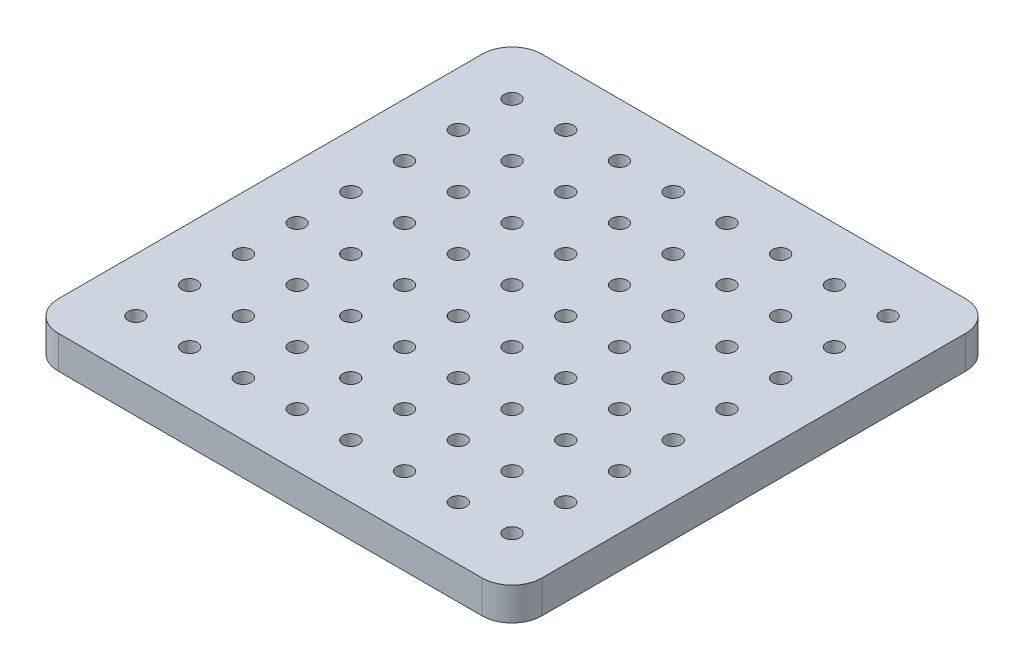
from build123d import *

# Parameters (mm, degrees)
SKETCH1_W               = 162
SKETCH1_H               = 162
BOSS_EXTRUDE1_DEPTH     = 5.5
SKETCH2_R               = 2.65
CUT_EXTRUDE1_DEPTH      = 10
MIRROR2_COPY_1_SKETCH_R = 2.65
MIRROR2_COPY_1_DEPTH    = 10
FILLET1_R               = 10


with BuildPart() as part:
    # Sketch1 → Boss-Extrude1 (new, symmetric)
    with BuildSketch(Plane(origin=(0, 0, 0), x_dir=(1, 0, 0), z_dir=(0, 1, 0))):
        Rectangle(SKETCH1_W, SKETCH1_H)
    extrude(amount=BOSS_EXTRUDE1_DEPTH, both=True)

    # Sketch2 → Cut-Extrude1 (cut)
    with BuildSketch(Plane(origin=(0, 5.5, 0), x_dir=(1, 0, 0), z_dir=(0, 1, 0))):
        with Locations(Location((9, -9, 0), (0, 0, 270))):
            Circle(SKETCH2_R)
        with Locations(Location((27, -9, 0), (0, 0, 270))):
            Circle(SKETCH2_R)
        with Locations(Location((45, -9, 0), (0, 0, 270))):
            Circle(SKETCH2_R)
        with Locations(Location((63, -9, 0), (0, 0, 270))):
            Circle(SKETCH2_R)
        with Locations(Location((9, -27, 0), (0, 0, 270))):
            Circle(SKETCH2_R)
        with Locations(Location((27, -27, 0), (0, 0, 270))):
            Circle(SKETCH2_R)
        with Locations(Location((45, -27, 0), (0, 0, 270))):
            Circle(SKETCH2_R)
        with Locations(Location((63, -27, 0), (0, 0, 270))):
            Circle(SKETCH2_R)
        with Locations(Location((9, -45, 0), (0, 0, 270))):
            Circle(SKETCH2_R)
        with Locations(Location((27, -45, 0), (0, 0, 270))):
            Circle(SKETCH2_R)
        with Locations(Location((45, -45, 0), (0, 0, 270))):
            Circle(SKETCH2_R)
        with Locations(Location((63, -45, 0), (0, 0, 270))):
            Circle(SKETCH2_R)
        with Locations(Location((9, -63, 0), (0, 0, 270))):
            Circle(SKETCH2_R)
        with Locations(Location((27, -63, 0), (0, 0, 270))):
            Circle(SKETCH2_R)
        with Locations(Location((45, -63, 0), (0, 0, 270))):
            Circle(SKETCH2_R)
        with Locations(Location((63, -63, 0), (0, 0, 270))):
            Circle(SKETCH2_R)
    cut_extrude1 = extrude(amount=-CUT_EXTRUDE1_DEPTH, mode=Mode.SUBTRACT)

    # Mirror1: Cut-Extrude1 across plane
    add(cut_extrude1.mirror(Plane.XY), mode=Mode.SUBTRACT)

    # Mirror2: Cut-Extrude1 across plane
    add(cut_extrude1.mirror(Plane(origin=(0, 0, 0), x_dir=(0, 0, 1), z_dir=(1, 0, 0))), mode=Mode.SUBTRACT)

    # Mirror2 copy 1 sketch → Mirror2 copy 1 (cut)
    with BuildSketch(Plane(origin=(0, 5.5, 0), x_dir=(-1, 0, 0), z_dir=(0, 1, 0))):
        with Locations(Location((9, -9, 0), (0, 0, 270))):
            Circle(MIRROR2_COPY_1_SKETCH_R)
        with Locations(Location((27, -9, 0), (0, 0, 270))):
            Circle(MIRROR2_COPY_1_SKETCH_R)
        with Locations(Location((45, -9, 0), (0, 0, 270))):
            Circle(MIRROR2_COPY_1_SKETCH_R)
        with Locations(Location((63, -9, 0), (0, 0, 270))):
            Circle(MIRROR2_COPY_1_SKETCH_R)
        with Locations(Location((9, -27, 0), (0, 0, 270))):
            Circle(MIRROR2_COPY_1_SKETCH_R)
        with Locations(Location((27, -27, 0), (0, 0, 270))):
            Circle(MIRROR2_COPY_1_SKETCH_R)
        with Locations(Location((45, -27, 0), (0, 0, 270))):
            Circle(MIRROR2_COPY_1_SKETCH_R)
        with Locations(Location((63, -27, 0), (0, 0, 270))):
            Circle(MIRROR2_COPY_1_SKETCH_R)
        with Locations(Location((9, -45, 0), (0, 0, 270))):
            Circle(MIRROR2_COPY_1_SKETCH_R)
        with Locations(Location((27, -45, 0), (0, 0, 270))):
            Circle(MIRROR2_COPY_1_SKETCH_R)
        with Locations(Location((45, -45, 0), (0, 0, 270))):
            Circle(MIRROR2_COPY_1_SKETCH_R)
        with Locations(Location((63, -45, 0), (0, 0, 270))):
            Circle(MIRROR2_COPY_1_SKETCH_R)
        with Locations(Location((9, -63, 0), (0, 0, 270))):
            Circle(MIRROR2_COPY_1_SKETCH_R)
        with Locations(Location((27, -63, 0), (0, 0, 270))):
            Circle(MIRROR2_COPY_1_SKETCH_R)
        with Locations(Location((45, -63, 0), (0, 0, 270))):
            Circle(MIRROR2_COPY_1_SKETCH_R)
        with Locations(Location((63, -63, 0), (0, 0, 270))):
            Circle(MIRROR2_COPY_1_SKETCH_R)
    extrude(amount=-MIRROR2_COPY_1_DEPTH, mode=Mode.SUBTRACT)

    # Fillet1
    fillet1_edges = [part.edges().sort_by_distance(p)[0] for p in [
        (81, 0, 81),
        (-81, 0, 81),
        (-81, 0, -81),
        (81, 0, -81),
    ]]
    fillet(fillet1_edges, radius=FILLET1_R)


solid = part.part
